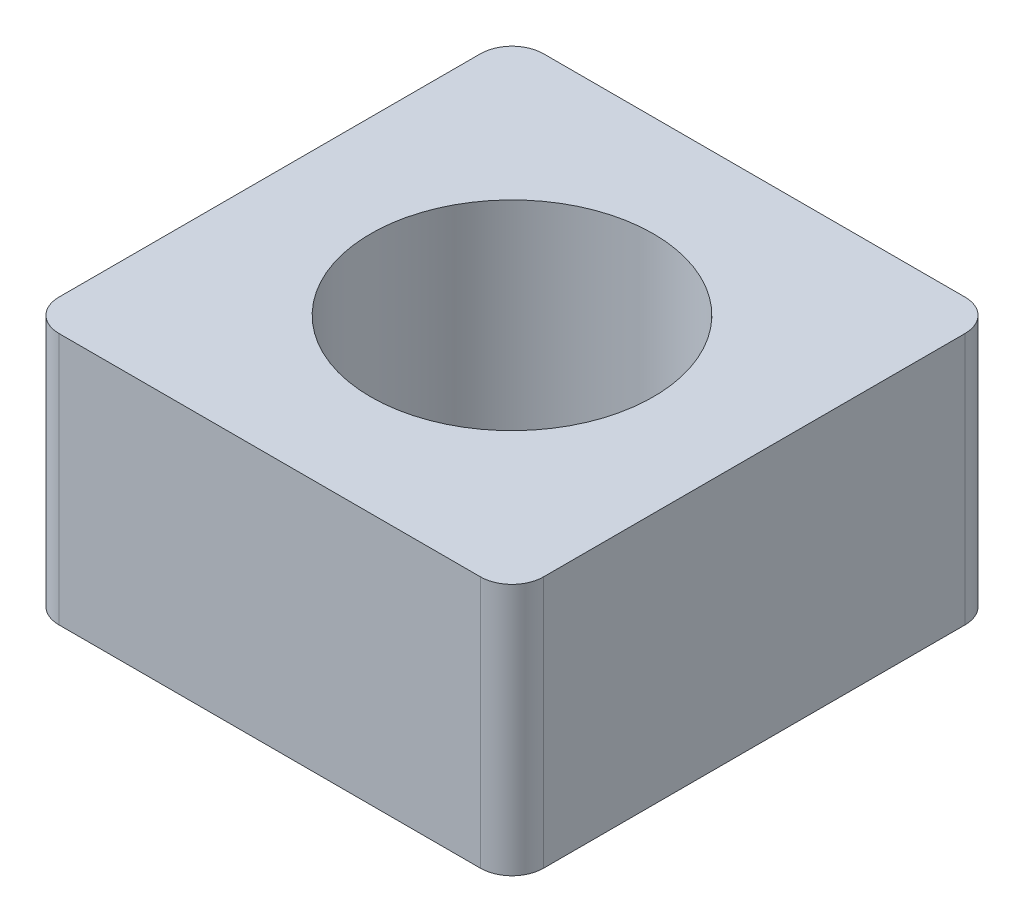
from build123d import *

# Parameters (mm, degrees)
SKETCH1_W           = 6.096
SKETCH1_H           = 6.096
SKETCH1_R           = 1.778
BOSS_EXTRUDE1_DEPTH = 3.175
FILLET1_R           = 0.396875


with BuildPart() as part:
    # Sketch1 → Boss-Extrude1 (new body)
    with BuildSketch(Plane(origin=(0, 0, 0), x_dir=(1, 0, 0), z_dir=(0, 1, 0))):
        Rectangle(SKETCH1_W, SKETCH1_H)
        with Locations(Location((0, 0, 0), (0, 0, 270))):
            Circle(SKETCH1_R, mode=Mode.SUBTRACT)
    extrude(amount=BOSS_EXTRUDE1_DEPTH)

    # Fillet1
    fillet1_edges = [part.edges().sort_by_distance(p)[0] for p in [
        (3.048, 1.5875, 3.048),
        (-3.048, 1.5875, 3.048),
        (-3.048, 1.5875, -3.048),
        (3.048, 1.5875, -3.048),
    ]]
    fillet(fillet1_edges, radius=FILLET1_R)


solid = part.part
